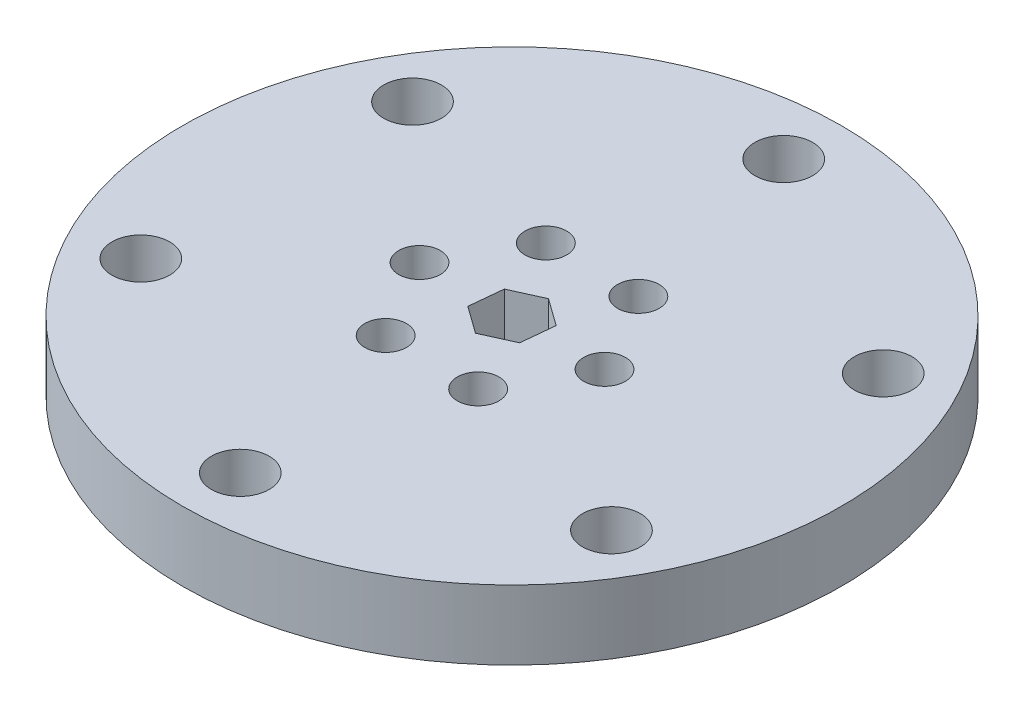
from build123d import *

# Parameters (mm, degrees)
SKETCH1_R           = 28.5
SKETCH1_R_2         = 2.5
BOSS_EXTRUDE1_DEPTH = 6
CUT_EXTRUDE1_DEPTH  = 8
SKETCH3_R           = 1.8
CUT_EXTRUDE2_DEPTH  = 10.54


with BuildPart() as part:
    # Sketch1 → Boss-Extrude1 (new body)
    with BuildSketch(Plane(origin=(0, 0, 0), x_dir=(1, 0, 0), z_dir=(0, 1, 0))):
        with Locations(Location((0, 0, 0), (0, 0, 270))):
            Circle(SKETCH1_R)
        with Locations(Location((0, 23.5, 0), (0, 0, 270))):
            Circle(SKETCH1_R_2, mode=Mode.SUBTRACT)
        with Locations(Location((20.351596989, 11.75, 0), (0, 0, 270))):
            Circle(SKETCH1_R_2, mode=Mode.SUBTRACT)
        with Locations(Location((20.351596989, -11.75, 0), (0, 0, 270))):
            Circle(SKETCH1_R_2, mode=Mode.SUBTRACT)
        with Locations(Location((0, -23.5, 0), (0, 0, 270))):
            Circle(SKETCH1_R_2, mode=Mode.SUBTRACT)
        with Locations(Location((-20.351596989, -11.75, 0), (0, 0, 270))):
            Circle(SKETCH1_R_2, mode=Mode.SUBTRACT)
        with Locations(Location((-20.351596989, 11.75, 0), (0, 0, 270))):
            Circle(SKETCH1_R_2, mode=Mode.SUBTRACT)
    extrude(amount=BOSS_EXTRUDE1_DEPTH)

    # Sketch2 → Cut-Extrude1 (cut)
    with BuildSketch(Plane(origin=(0, 6, 0), x_dir=(1, 0, 0), z_dir=(0, 1, 0))):
        Polygon((-0.284546252, -2.872693294), (2.345552244, -1.68277093), (2.630098496, 1.189922365), (0.284546252, 2.872693294), (-2.345552244, 1.68277093), (-2.630098496, -1.189922365), align=None)
    extrude(amount=-CUT_EXTRUDE1_DEPTH, mode=Mode.SUBTRACT)

    # Sketch3 → Cut-Extrude2 (cut)
    with BuildSketch(Plane(origin=(0, 6, 0), x_dir=(1, 0, 0), z_dir=(0, 1, 0))):
        with Locations(Location((8, 0, 0), (0, 0, 270))):
            Circle(SKETCH3_R)
        with Locations(Location((4, -6.92820323, 0), (0, 0, 270))):
            Circle(SKETCH3_R)
        with Locations(Location((-4, -6.92820323, 0), (0, 0, 270))):
            Circle(SKETCH3_R)
        with Locations(Location((-8, 0, 0), (0, 0, 270))):
            Circle(SKETCH3_R)
        with Locations(Location((-4, 6.92820323, 0), (0, 0, 270))):
            Circle(SKETCH3_R)
        with Locations(Location((4, 6.92820323, 0), (0, 0, 270))):
            Circle(SKETCH3_R)
    extrude(amount=-CUT_EXTRUDE2_DEPTH, mode=Mode.SUBTRACT)


solid = part.part
